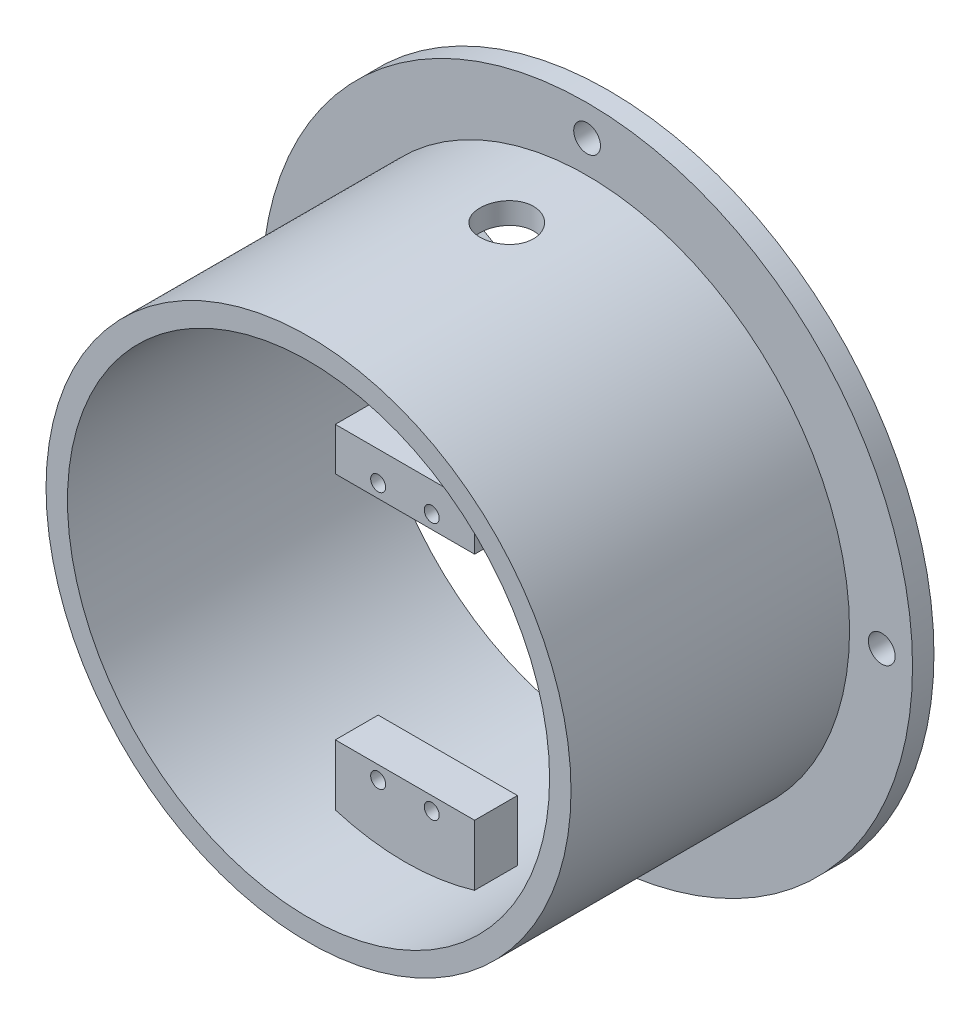
from build123d import *

# Parameters (mm, degrees)
SKETCH2_R           = 60.75
SKETCH2_R_2         = 45
BOSS_EXTRUDE1_DEPTH = 4
SKETCH3_R           = 49
SKETCH3_R_2         = 45
BOSS_EXTRUDE2_DEPTH = 52
SKETCH4_W           = 8
SKETCH4_H           = 38
SKETCH4_W_2         = 15
SKETCH4_H_2         = 8
BOSS_EXTRUDE3_DEPTH = 13
SKETCH5_W           = 10
SKETCH5_H           = 23
CUT_EXTRUDE1_DEPTH  = 8
SKETCH7_R           = 5
CUT_EXTRUDE2_DEPTH  = 110.592711893
SKETCH8_R           = 1.4
CUT_EXTRUDE5_DEPTH  = 7.2
BOSS_EXTRUDE4_DEPTH = 4
SKETCH10_R          = 2.5
CUT_EXTRUDE6_DEPTH  = 101.424723103


with BuildPart() as part:
    # Sketch2 → Boss-Extrude1 (new body)
    with BuildSketch(Plane(origin=(0, 0, 0), x_dir=(0, 1, 0), z_dir=(0, 0, 1))):
        with Locations(Location((0, 0, 0), (0, 0, 270))):
            Circle(SKETCH2_R)
        with Locations(Location((0, 0, 0), (0, 0, 270))):
            Circle(SKETCH2_R_2, mode=Mode.SUBTRACT)
    extrude(amount=BOSS_EXTRUDE1_DEPTH)

    # Sketch3 → Boss-Extrude2 (add)
    with BuildSketch(Plane.XY.offset(4)):
        with Locations(Location((0, 0, 0), (0, 0, 180))):
            Circle(SKETCH3_R)
        Circle(SKETCH3_R_2, mode=Mode.SUBTRACT)
    extrude(amount=BOSS_EXTRUDE2_DEPTH)

    # Sketch4 → Boss-Extrude3 (add, symmetric)
    with BuildSketch(Plane.YZ):
        with Locations((15.25, 19)):
            Rectangle(SKETCH4_W, SKETCH4_H)
        with Locations((-39.25, 34)):
            Rectangle(SKETCH4_W_2, SKETCH4_H_2)
    extrude(amount=BOSS_EXTRUDE3_DEPTH, both=True)


with BuildPart() as boss_extrude3_piece_1:
    # of the separate pieces the step leaves, piece 1, a body of its own (boss_extrude3_pieces)
    add(part.part.solids().sort_by_distance((60.75, 0, 0))[0])

    # Sketch7 → Cut-Extrude2 (cut, through all)
    with BuildSketch(Plane.XZ.offset(-11.25)):
        with Locations(Location((0, 19, 0), (0, 0, 270))):
            Circle(SKETCH7_R)
    extrude(amount=-CUT_EXTRUDE2_DEPTH, mode=Mode.SUBTRACT)


with BuildPart() as boss_extrude3_piece_2:
    # of the separate pieces the step leaves, piece 2, a body of its own (boss_extrude3_pieces)
    add(part.part.solids().sort_by_distance((-13, 11.25, 0))[0])

    # Sketch5 → Cut-Extrude1 (cut)
    with BuildSketch(Plane.XZ.offset(-11.25)):
        with Locations((0, 16.5)):
            Rectangle(SKETCH5_W, SKETCH5_H)
    extrude(amount=-CUT_EXTRUDE1_DEPTH, mode=Mode.SUBTRACT)


with BuildPart() as cut_extrude5_tool:
    # Sketch8 → Cut-Extrude5 (new body)
    with BuildSketch(Plane.XY.offset(38)):
        with Locations((5, -34.25)):
            Circle(SKETCH8_R)
        with Locations((5, 13.75)):
            Circle(SKETCH8_R)
        with Locations(Location((-5, 13.75, 0), (0, 0, 180))):
            Circle(SKETCH8_R)
        with Locations(Location((-5, -34.25, 0), (0, 0, 180))):
            Circle(SKETCH8_R)
    extrude(amount=-CUT_EXTRUDE5_DEPTH)


with BuildPart() as boss_extrude3_piece_1_1:
    add(boss_extrude3_piece_1.part)

    # Cut-Extrude5: cut by cut_extrude5_tool
    add(cut_extrude5_tool.part, mode=Mode.SUBTRACT)



with BuildPart() as boss_extrude3_piece_2_1:
    add(boss_extrude3_piece_2.part)

    # Cut-Extrude5: cut by cut_extrude5_tool
    add(cut_extrude5_tool.part, mode=Mode.SUBTRACT)


with BuildPart() as boss_extrude3_piece_1_2:
    add(boss_extrude3_piece_1_1.part)

    add(boss_extrude3_piece_2_1.part)  # Boss-Extrude4 merges Boss-Extrude3 piece 2
    # Sketch9 → Boss-Extrude4 (add)
    with BuildSketch(Plane(origin=(0, 0, 0), x_dir=(1, 0, 0), z_dir=(0, 0, -1))):
        with BuildLine():
            Line((13, -11.25), (-13, -11.25))
            Line((-13, -11.25), (-37.248431585, -25.249838503))
            ThreePointArc((-37.248431585, -25.249838503), (0, -45), (37.248431585, -25.249838503))
            Line((37.248431585, -25.249838503), (13, -11.25))
        make_face()
        with BuildLine():
            Line((19.516660498, -24.25), (24.906460381, -27.361802413))
            ThreePointArc((24.906460381, -27.361802413), (0, -37), (-24.906460381, -27.361802413))
            Line((-24.906460381, -27.361802413), (-19.516660498, -24.25))
            Line((-19.516660498, -24.25), (19.516660498, -24.25))
        make_face(mode=Mode.SUBTRACT)
    extrude(amount=-BOSS_EXTRUDE4_DEPTH)

    # Sketch10 → Cut-Extrude6 (cut, through all)
    with BuildSketch(Plane.XY.offset(4)):
        with Locations((-55, 0)):
            Circle(SKETCH10_R)
        with Locations((0, 55)):
            Circle(SKETCH10_R)
        with Locations((55, 0)):
            Circle(SKETCH10_R)
        with Locations((0, -55)):
            Circle(SKETCH10_R)
    extrude(amount=-CUT_EXTRUDE6_DEPTH, mode=Mode.SUBTRACT)


solid = boss_extrude3_piece_1_2.part
